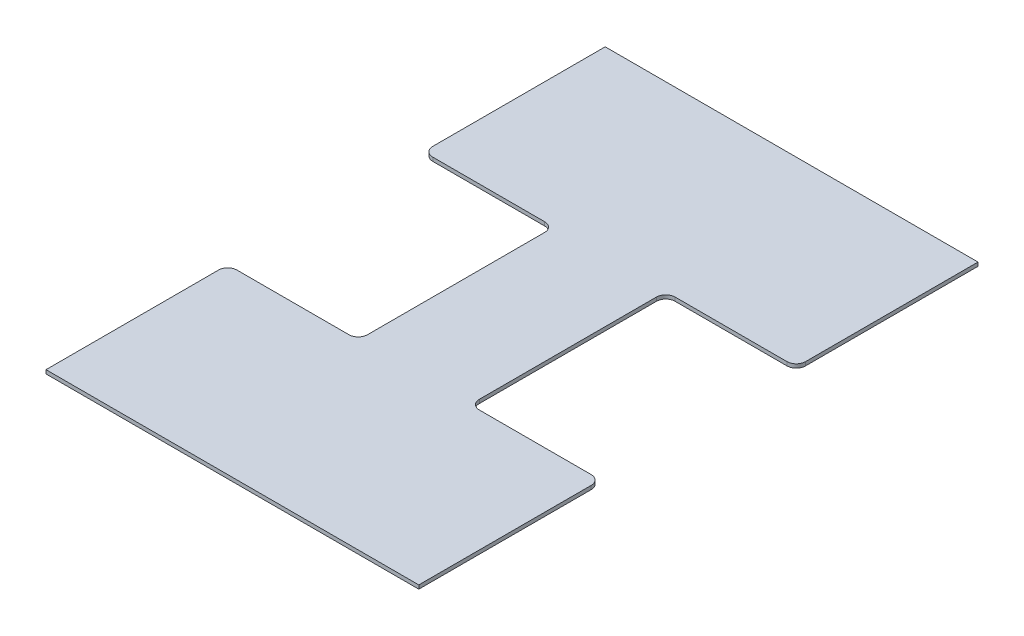
from build123d import *

# Parameters (mm, degrees)
SKETCH_1_W          = 400
SKETCH_1_H          = 600
EXTRUDE_1_DEPTH     = 4
SKETCH_2_W          = 140
SKETCH_2_H          = 210
CUT_EXTRUDE_3_DEPTH = 361.577314872
FILLET_1_R          = 10


with BuildPart() as part:
    # 草图1 → 凸台-拉伸1 (new body)
    with BuildSketch(Plane(origin=(0, 0, 0), x_dir=(1, 0, 0), z_dir=(0, 1, 0))):
        Rectangle(SKETCH_1_W, SKETCH_1_H)
    extrude(amount=EXTRUDE_1_DEPTH)

    # 草图2 → 切除-拉伸3 (cut, through all)
    with BuildSketch(Plane(origin=(0, 4, 0), x_dir=(1, 0, 0), z_dir=(0, 1, 0))):
        with Locations((-130, 0)):
            Rectangle(SKETCH_2_W, SKETCH_2_H)
    cut_extrude_3 = extrude(amount=-CUT_EXTRUDE_3_DEPTH, mode=Mode.SUBTRACT)

    # 镜向1: 切除-拉伸3 across plane
    add(cut_extrude_3.mirror(Plane(origin=(0, 0, 0), x_dir=(0, 0, 1), z_dir=(1, 0, 0))), mode=Mode.SUBTRACT)

    # 圆角1
    fillet_1_edges = [part.edges().sort_by_distance(p)[0] for p in [
        (-60, 2, -105),
        (-60, 2, 105),
        (-200, 2, 105),
        (-200, 2, -105),
        (60, 2, 105),
        (60, 2, -105),
        (200, 2, -105),
        (200, 2, 105),
    ]]
    fillet(fillet_1_edges, radius=FILLET_1_R)


solid = part.part
